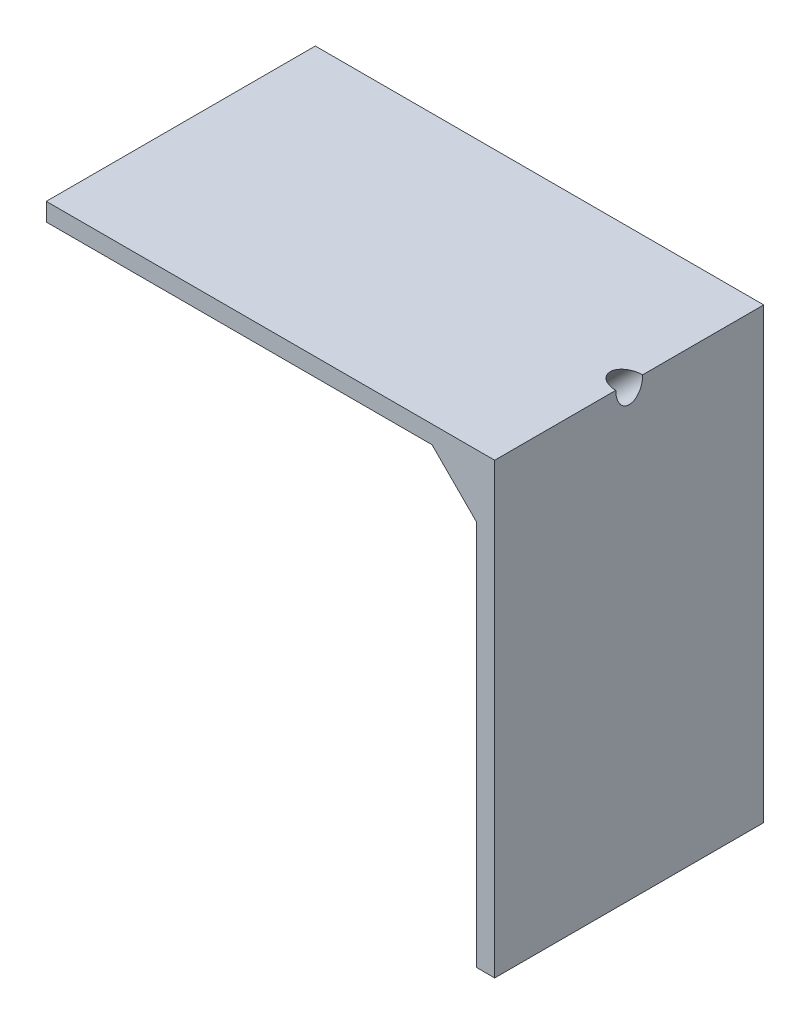
from build123d import *

# Parameters (mm, degrees)
AUFSATZ_LINEAR_AUSTRAGEN1_DEPTH = 30
AUFSATZ_LINEAR_AUSTRAGEN2_DEPTH = 30
SKIZZE3_R                       = 1.5
SCHNITT_LINEAR_AUSTRAGEN1_DEPTH = 30


with BuildPart() as part:
    # Skizze1 → Aufsatz-Linear austragen1 (new body)
    with BuildSketch(Plane.XY):
        Polygon((22.204821564, 4.083333333), (-27.795178436, 4.083333333), (-27.795178436, 2.083333333), (20.204821564, 2.083333333), (20.204821564, -45.916666667), (22.204821564, -45.916666667), align=None)
    extrude(amount=AUFSATZ_LINEAR_AUSTRAGEN1_DEPTH)

    # Skizze2 → Aufsatz-Linear austragen2 (add)
    with BuildSketch(Plane.XY.offset(30)):
        Polygon((15.215533088, 2.083333333), (20.204821564, -2.916666667), (20.204821564, 2.083333333), align=None)
    extrude(amount=-AUFSATZ_LINEAR_AUSTRAGEN2_DEPTH)

    # Skizze3 → Schnitt-Linear austragen1 (cut)
    with BuildSketch(Plane(origin=(8.665746428, 8.647181758, 0), x_dir=(0, 0, 1), z_dir=(-0.7078646055315657, -0.7063481437900443, 0))):
        with Locations((15, -12.806243307)):
            Circle(SKIZZE3_R)
    extrude(amount=-SCHNITT_LINEAR_AUSTRAGEN1_DEPTH, mode=Mode.SUBTRACT)


solid = part.part
